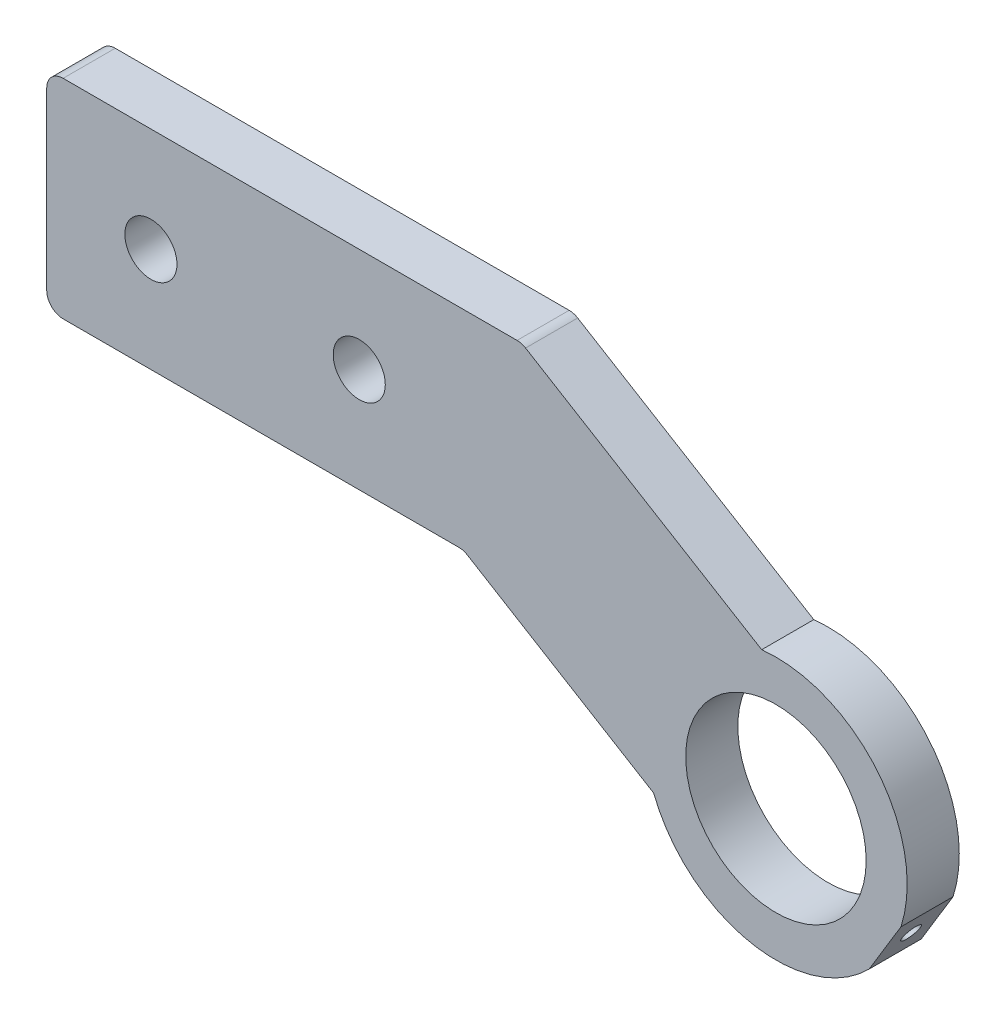
from build123d import *

# Parameters (mm, degrees)
SKETCH1_R               = 3.175
SKETCH1_R_2             = 11
BOSS_EXTRUDE1_DEPTH     = 6.35
FILLET3_R               = 2
CUT_EXTRUDE1_REACH      = 111.565
CUT_EXTRUDE1_END_RADIUS = 11
SKETCH2_R               = 1.1303


with BuildPart() as part:
    # Sketch1 → Boss-Extrude1 (new body)
    with BuildSketch(Plane.XY):
        with BuildLine():
            Line((-38.1, -12.7), (-38.1, 12.7))
            Line((-38.1, 12.7), (19.799208724, 12.7))
            Line((19.799208724, 12.7), (49.063216326, -5.044542368))
            ThreePointArc((49.063216326, -5.044542368), (63.185378941, -10.82071629), (66.044603929, -25.808194216))
            Line((66.044603929, -25.808194216), (62.155933896, -32.221324916))
            ThreePointArc((62.155933896, -32.221324916), (47.544550454, -36.615313538), (35.893587146, -26.763678338))
            Line((35.893587146, -26.763678338), (12.7, -12.7))
            Line((12.7, -12.7), (-38.1, -12.7))
        make_face()
        with Locations((-25.4, 0)):
            Circle(SKETCH1_R, mode=Mode.SUBTRACT)
        Circle(SKETCH1_R, mode=Mode.SUBTRACT)
        with Locations((50.8, -20.95)):
            Circle(SKETCH1_R_2, mode=Mode.SUBTRACT)
    extrude(amount=BOSS_EXTRUDE1_DEPTH)

    # Fillet3
    fillet3_edges = [part.edges().sort_by_distance(p)[0] for p in [
        (-38.1, -12.7, 3.175),
        (-38.1, 12.7, 3.175),
        (19.799208724, 12.7, 3.175),
        (12.7, -12.7, 3.175),
    ]]
    fillet(fillet3_edges, radius=FILLET3_R)

    # Cut-Extrude1: up to this cylinder (the profile starts outside it)
    cut_extrude1_end = Plane(origin=(50.8, -20.95, 3.175), z_dir=(0, 0, -1)) * Cylinder(CUT_EXTRUDE1_END_RADIUS, 246.13, mode=Mode.PRIVATE)
    # Sketch2 → Cut-Extrude1 (cut, up to the surface)
    with BuildSketch(Plane(origin=(59.73186838, -36.21905392, 0), x_dir=(0, 0, -1), z_dir=(0.855084093292463, -0.5184893377864259, 0)), mode=Mode.PRIVATE) as cut_extrude1_sk1:
        with Locations(Location((-3.175, 8.425246605, 0), (0, 0, 90))):
            Circle(SKETCH2_R)
    cut_extrude1_tool1 = extrude(cut_extrude1_sk1.sketch, amount=-CUT_EXTRUDE1_REACH, mode=Mode.PRIVATE) - cut_extrude1_end
    add(cut_extrude1_tool1.solids().sort_by_distance((64.100269, -29.01476, 3.175))[0], mode=Mode.SUBTRACT)


solid = part.part
